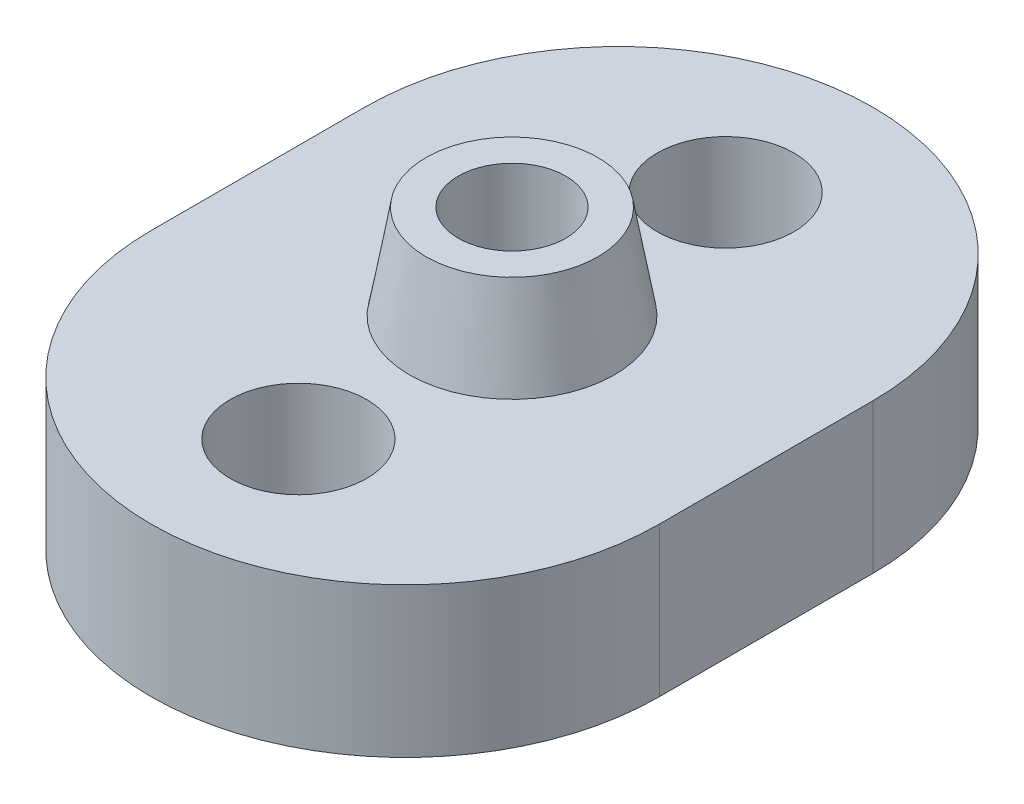
from build123d import *

# Parameters (mm, degrees)
SKETCH1_R               = 2.4
BOSS_EXTRUDE1_DEPTH     = 2.2
BOSS_EXTRUDE1_TAPER     = 10
SKETCH2_R               = 1.6
BOSS_EXTRUDE2_DEPTH     = 3.5
CUT_EXTRUDE1_DEPTH      = 12.802330327
CUT_EXTRUDE1_DEPTH_BACK = 12.802330327
SKETCH4_R               = 1.26


with BuildPart() as part:
    # Sketch1 → Boss-Extrude1 (new body)
    with BuildSketch(Plane(origin=(0, 0, 0), x_dir=(1, 0, 0), z_dir=(0, 1, 0))):
        Circle(SKETCH1_R)
    extrude(amount=BOSS_EXTRUDE1_DEPTH, taper=BOSS_EXTRUDE1_TAPER)

    # Sketch2 → Boss-Extrude2 (add)
    with BuildSketch(Plane.XZ):
        with BuildLine():
            Line((-5.95, -2.5), (-5.95, 2.5))
            ThreePointArc((-5.95, 2.5), (0, 8.45), (5.95, 2.5))
            Line((5.95, 2.5), (5.95, -2.5))
            ThreePointArc((5.95, -2.5), (0, -8.45), (-5.95, -2.5))
        make_face()
        with Locations(Location((0, -5, 0), (0, 0, 270))):
            Circle(SKETCH2_R, mode=Mode.SUBTRACT)
        with Locations(Location((0, 5, 0), (0, 0, 270))):
            Circle(SKETCH2_R, mode=Mode.SUBTRACT)
    extrude(amount=BOSS_EXTRUDE2_DEPTH)

    # Sketch4 → Cut-Extrude1 (cut, two sides: drawn at the far end of the back side and taken through both)
    with BuildSketch(Plane.XZ.offset(3.5).offset(-CUT_EXTRUDE1_DEPTH_BACK)):
        with Locations(Location((0, 0, 0), (0, 0, 270))):
            Circle(SKETCH4_R)
    extrude(amount=CUT_EXTRUDE1_DEPTH + CUT_EXTRUDE1_DEPTH_BACK, mode=Mode.SUBTRACT)


solid = part.part
